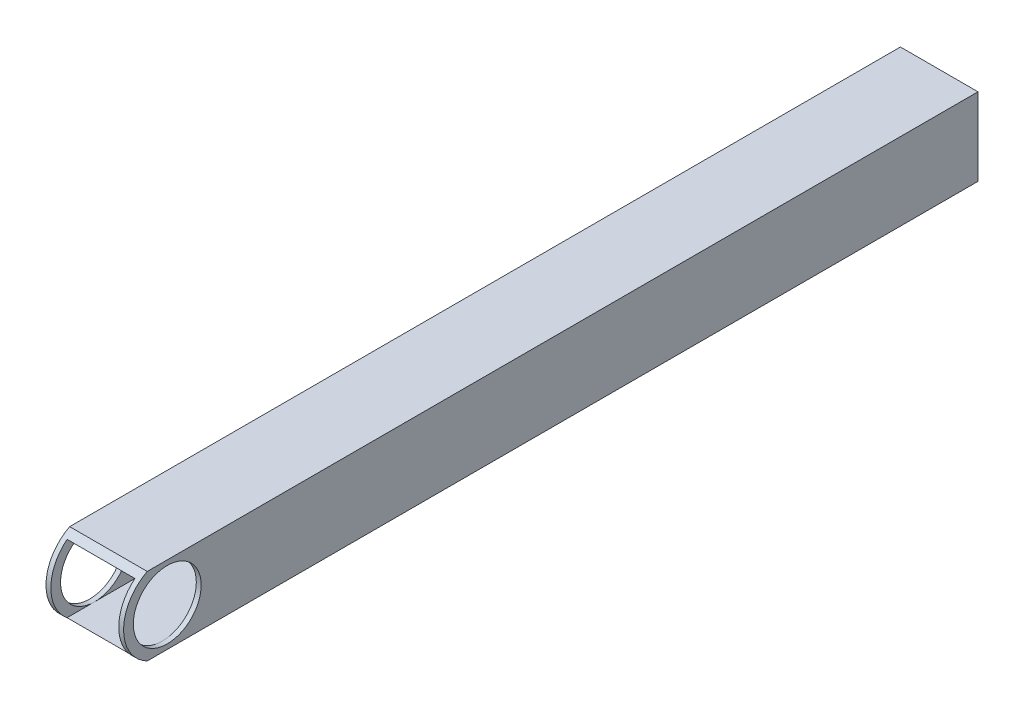
from build123d import *

# Parameters (mm, degrees)
SKETCH1_W           = 25.4
SKETCH1_H           = 25.4
SKETCH1_W_2         = 22.225
SKETCH1_H_2         = 22.225
EXTRUDE_THIN1_DEPTH = 142.24
SKETCH2_R           = 11.1125
CUT_EXTRUDE1_DEPTH  = 146.047121998
CUT_EXTRUDE2_DEPTH  = 146.047121998


with BuildPart() as part:
    # Sketch1 → Extrude-Thin1 (new, symmetric)
    with BuildSketch(Plane.XY):
        Rectangle(SKETCH1_W, SKETCH1_H)
        Rectangle(SKETCH1_W_2, SKETCH1_H_2, mode=Mode.SUBTRACT)
    extrude(amount=EXTRUDE_THIN1_DEPTH, both=True)

    # Sketch2 → Cut-Extrude1 (cut, through all)
    with BuildSketch(Plane(origin=(12.7, 0, 0), x_dir=(0, 0, -1), z_dir=(1, 0, 0))):
        with Locations((-123.19, 0)):
            Circle(SKETCH2_R)
    extrude(amount=-CUT_EXTRUDE1_DEPTH, mode=Mode.SUBTRACT)

    # Sketch3 → Cut-Extrude2 (cut, through all)
    with BuildSketch(Plane(origin=(12.7, 0, 0), x_dir=(0, 0, -1), z_dir=(1, 0, 0))):
        with BuildLine():
            Line((-123.19, 14.2875), (-142.24, 14.2875))
            Line((-142.24, 14.2875), (-142.24, -12.7))
            Line((-142.24, -12.7), (-129.735430181, -12.7))
            ThreePointArc((-129.735430181, -12.7), (-137.0749542, 3.367596045), (-123.19, 14.2875))
        make_face()
    extrude(amount=-CUT_EXTRUDE2_DEPTH, mode=Mode.SUBTRACT)


solid = part.part
